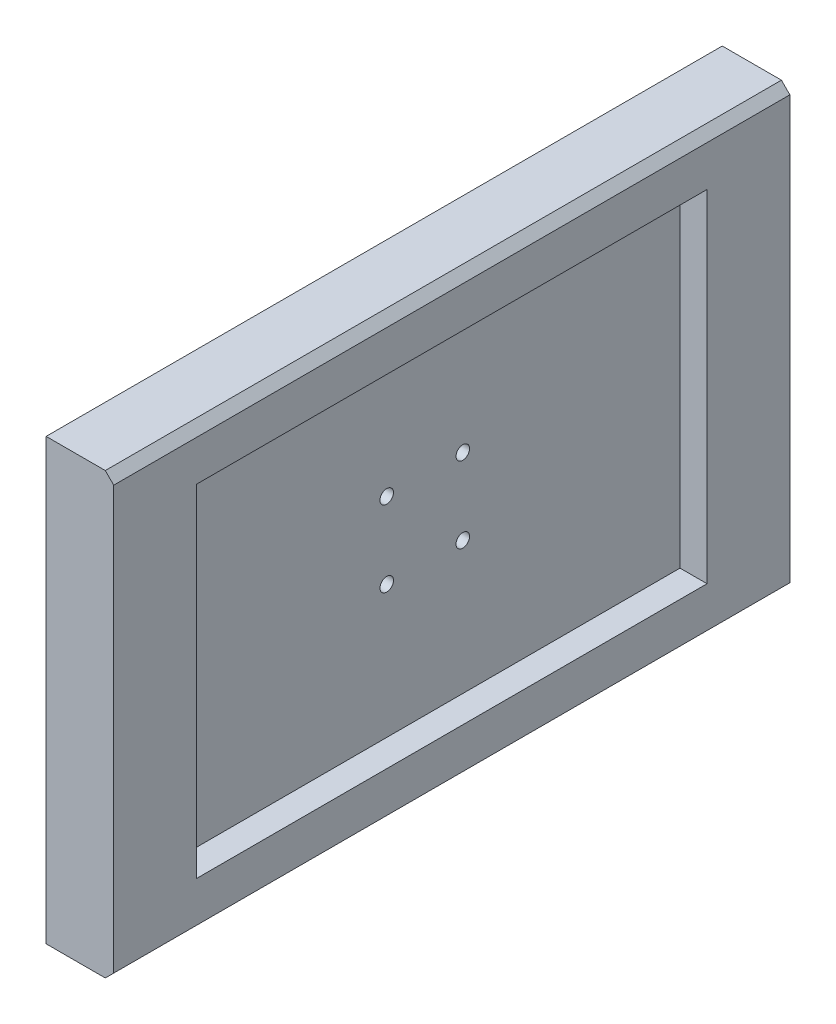
from build123d import *

# Parameters (mm, degrees)
SKETCH1_W           = 80
SKETCH1_H           = 52
BOSS_EXTRUDE1_DEPTH = 8
SKETCH2_R           = 0.8
CUT_EXTRUDE2_DEPTH  = 5
SKETCH3_W           = 60.4
SKETCH3_H           = 40.4
CUT_EXTRUDE3_DEPTH  = 3.2
CHAMFER1_SIZE       = 1


with BuildPart() as part:
    # Sketch1 → Boss-Extrude1 (new body)
    with BuildSketch(Plane(origin=(33.5, 0, 0), x_dir=(0, 0, -1), z_dir=(1, 0, 0))):
        Rectangle(SKETCH1_W, SKETCH1_H)
    extrude(amount=BOSS_EXTRUDE1_DEPTH)

    # Sketch2 → Cut-Extrude2 (cut)
    with BuildSketch(Plane(origin=(33.5, 0, 0), x_dir=(0, 0, -1), z_dir=(1, 0, 0))):
        with Locations((-4.5, -4.5)):
            Circle(SKETCH2_R)
        with Locations((4.5, -4.5)):
            Circle(SKETCH2_R)
        with Locations((-4.5, 4.5)):
            Circle(SKETCH2_R)
        with Locations((4.5, 4.5)):
            Circle(SKETCH2_R)
    extrude(amount=CUT_EXTRUDE2_DEPTH, mode=Mode.SUBTRACT)

    # Sketch3 → Cut-Extrude3 (cut)
    with BuildSketch(Plane(origin=(41.5, 0, 0), x_dir=(0, 0, -1), z_dir=(1, 0, 0))):
        Rectangle(SKETCH3_W, SKETCH3_H)
    extrude(amount=-CUT_EXTRUDE3_DEPTH, mode=Mode.SUBTRACT)

    # Chamfer1
    chamfer1_edges = [part.edges().sort_by_distance(p)[0] for p in [
        (41.5, 26, 0),
        (41.5, -26, 0),
    ]]
    chamfer(chamfer1_edges, length=CHAMFER1_SIZE)


solid = part.part
